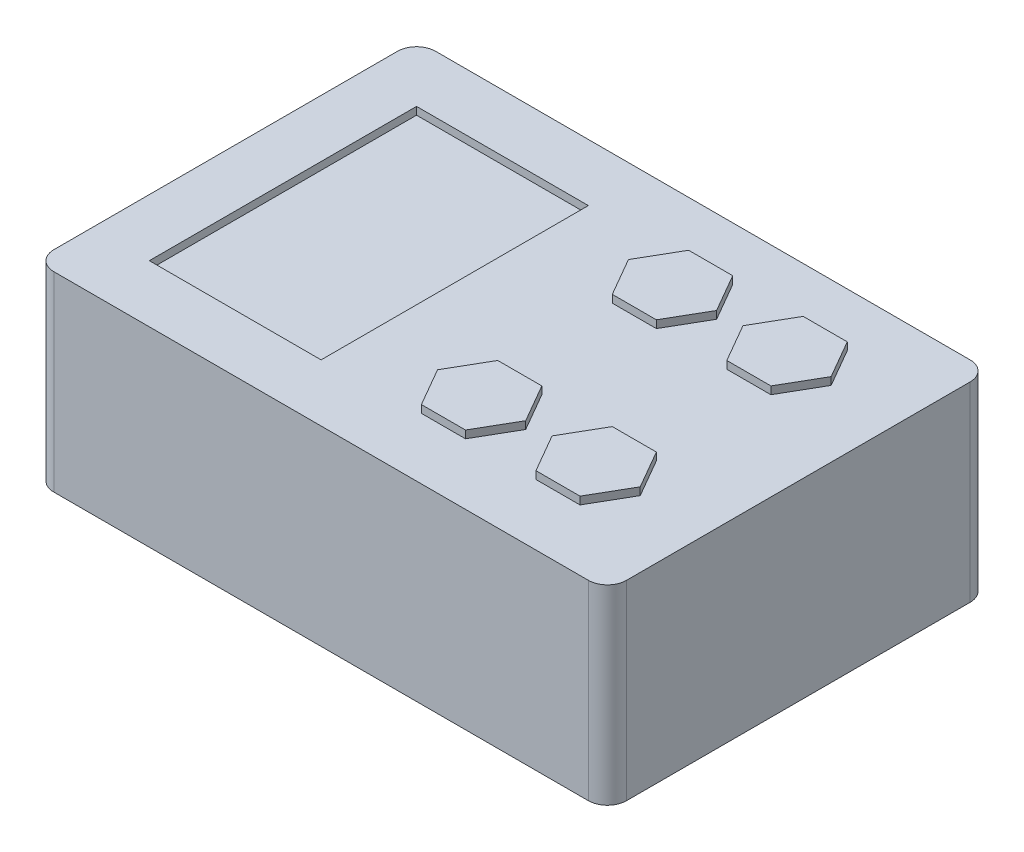
from build123d import *

# Parameters (mm, degrees)
SKETCH1_W           = 150
SKETCH1_H           = 100
BOSS_EXTRUDE1_DEPTH = 50
SHELL1_T            = 3
SKETCH3_R           = 30
CUT_EXTRUDE2_DEPTH  = 5
SKETCH4_W           = 45
SKETCH4_H           = 70
CUT_EXTRUDE3_DEPTH  = 2
BOSS_EXTRUDE2_DEPTH = 2
FILLET1_R           = 5


with BuildPart() as part:
    # Sketch1 → Boss-Extrude1 (new body)
    with BuildSketch(Plane(origin=(0, 0, 0), x_dir=(1, 0, 0), z_dir=(0, 1, 0))):
        Rectangle(SKETCH1_W, SKETCH1_H)
    extrude(amount=BOSS_EXTRUDE1_DEPTH)

    # Shell1 (no face opened: a closed hollow body)
    add(offset(amount=-SHELL1_T, mode=Mode.PRIVATE), mode=Mode.SUBTRACT)

    # Sketch3 → Cut-Extrude2 (cut)
    with BuildSketch(Plane.XZ):
        with Locations(Location((37, 0, 0), (0, 0, 270))):
            Circle(SKETCH3_R)
        with Locations(Location((-37, 0, 0), (0, 0, 270))):
            Circle(SKETCH3_R)
    extrude(amount=-CUT_EXTRUDE2_DEPTH, mode=Mode.SUBTRACT)

    # Sketch4 → Cut-Extrude3 (cut)
    with BuildSketch(Plane(origin=(0, 50, 0), x_dir=(1, 0, 0), z_dir=(0, 1, 0))):
        with Locations((-37.5, 0)):
            Rectangle(SKETCH4_W, SKETCH4_H)
    extrude(amount=-CUT_EXTRUDE3_DEPTH, mode=Mode.SUBTRACT)

    # Sketch5 → Boss-Extrude2 (add)
    with BuildSketch(Plane(origin=(0, 50, 0), x_dir=(1, 0, 0), z_dir=(0, 1, 0))):
        Polygon((57.58863582, -24), (51.815133128, -14), (40.268127744, -14), (34.494625052, -24), (40.268127744, -34), (51.815133128, -34), align=None)
        Polygon((27.58863582, -24), (21.815133128, -14), (10.268127744, -14), (4.494625052, -24), (10.268127744, -34), (21.815133128, -34), align=None)
        Polygon((57.58863582, 26), (51.815133128, 36), (40.268127744, 36), (34.494625052, 26), (40.268127744, 16), (51.815133128, 16), align=None)
        Polygon((27.58863582, 26), (21.815133128, 36), (10.268127744, 36), (4.494625052, 26), (10.268127744, 16), (21.815133128, 16), align=None)
    extrude(amount=BOSS_EXTRUDE2_DEPTH)

    # Fillet1
    fillet1_edges = [part.edges().sort_by_distance(p)[0] for p in [
        (75, 25, 50),
        (-75, 25, 50),
        (-75, 25, -50),
        (75, 25, -50),
    ]]
    fillet(fillet1_edges, radius=FILLET1_R)


solid = part.part
